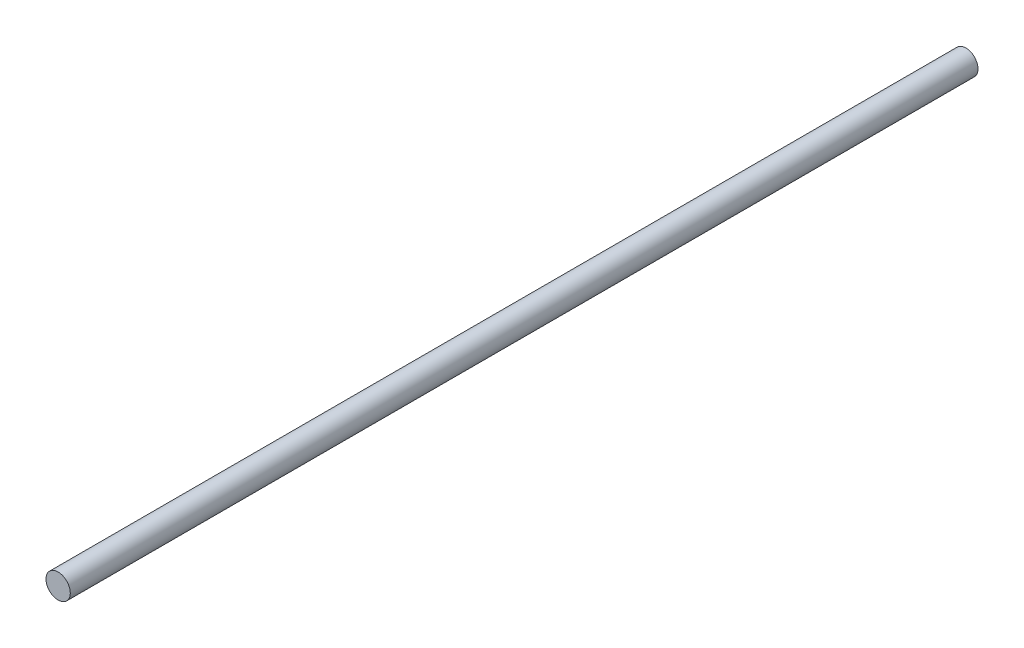
from build123d import *

# Parameters (mm, degrees)
SKETCH1_R           = 5
BOSS_EXTRUDE1_DEPTH = 373.35


with BuildPart() as part:
    # Sketch1 → Boss-Extrude1 (new body)
    with BuildSketch(Plane.XY):
        Circle(SKETCH1_R)
    extrude(amount=BOSS_EXTRUDE1_DEPTH)


solid = part.part
